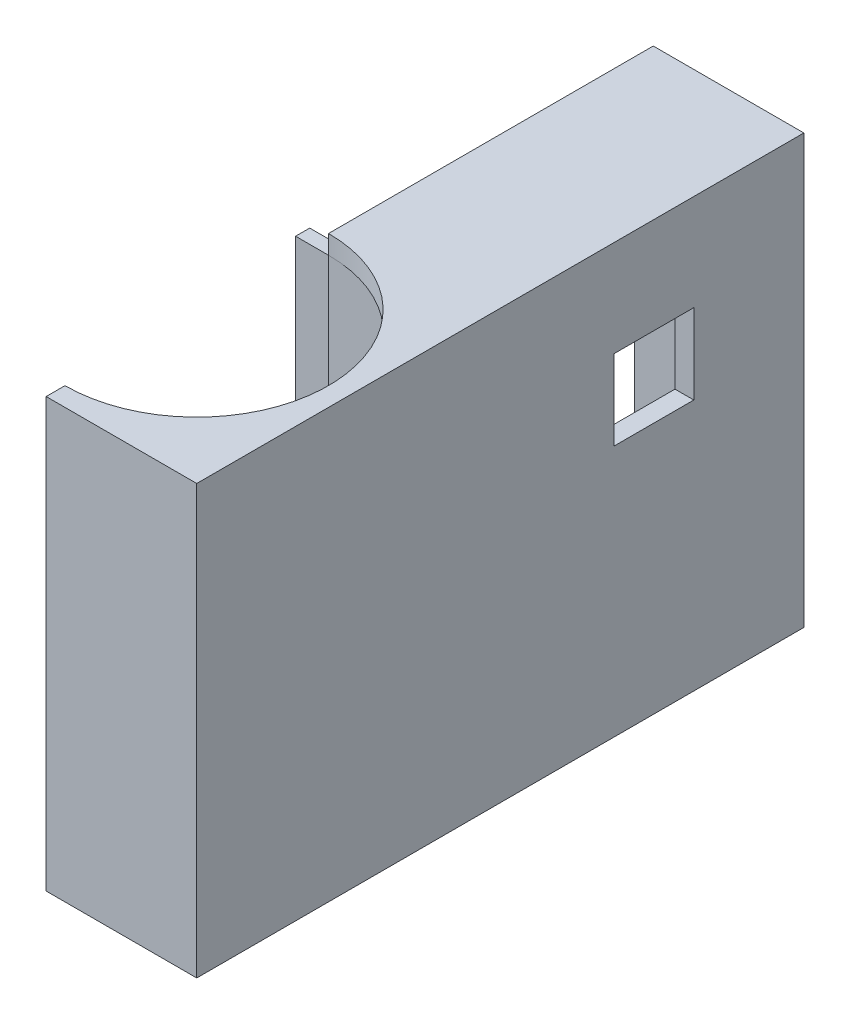
from build123d import *

# Parameters (mm, degrees)
SKETCH1_W           = 64.5
SKETCH1_H           = 45.5
SKETCH1_W_2         = 8.5
SKETCH1_H_2         = 8.5
BOSS_EXTRUDE1_DEPTH = 2
SKETCH2_W           = 64.5
SKETCH2_H           = 45.5
SKETCH2_W_2         = 28
SKETCH2_H_2         = 41.5
BOSS_EXTRUDE2_DEPTH = 14
CUT_EXTRUDE1_REACH  = 80.565
SKETCH3_R           = 14
SKETCH4_W           = 1.5
SKETCH4_H           = 38.5
BOSS_EXTRUDE3_DEPTH = 5
SKETCH5_W           = 15.24
SKETCH5_H           = 2
CUT_EXTRUDE2_DEPTH  = 7.62


with BuildPart() as part:
    # Sketch1 → Boss-Extrude1 (new body)
    with BuildSketch(Plane(origin=(0, 0, 0), x_dir=(0, 0, -1), z_dir=(1, 0, 0))):
        with Locations((30.25, 20.75)):
            Rectangle(SKETCH1_W, SKETCH1_H)
        with Locations((46.5590026, 29.024)):
            Rectangle(SKETCH1_W_2, SKETCH1_H_2, mode=Mode.SUBTRACT)
    extrude(amount=BOSS_EXTRUDE1_DEPTH)

    # Sketch2 → Boss-Extrude2 (add)
    with BuildSketch(Plane.ZY):
        with Locations((-30.25, 20.75)):
            Rectangle(SKETCH2_W, SKETCH2_H)
        with Locations((-46.5, 20.75)):
            Rectangle(SKETCH2_W_2, SKETCH2_H_2, mode=Mode.SUBTRACT)
        with Locations((-14, 20.75)):
            Rectangle(SKETCH2_W_2, SKETCH2_H_2, mode=Mode.SUBTRACT)
    extrude(amount=BOSS_EXTRUDE2_DEPTH)

    # Sketch3 → Cut-Extrude1 (cut, up to next)
    with BuildSketch(Plane(origin=(0, 43.5, 0), x_dir=(1, 0, 0), z_dir=(0, 1, 0)), mode=Mode.PRIVATE) as cut_extrude1_sk1:
        with Locations((-14, 14)):
            Circle(SKETCH3_R)
    cut_extrude1_tool1 = extrude(cut_extrude1_sk1.sketch, amount=-CUT_EXTRUDE1_REACH, mode=Mode.PRIVATE) & part.part
    add(cut_extrude1_tool1.solids().sort_by_distance((-14, 43.5, -14))[0], mode=Mode.SUBTRACT)

    # Sketch4 → Boss-Extrude3 (add)
    with BuildSketch(Plane.ZY.offset(14)):
        with Locations((-30.25, 20.75)):
            Rectangle(SKETCH4_W, SKETCH4_H)
    extrude(amount=BOSS_EXTRUDE3_DEPTH)

    # Sketch5 → Cut-Extrude2 (cut)
    with BuildSketch(Plane.ZY.offset(14)):
        with Locations((-47.26, -1)):
            Rectangle(SKETCH5_W, SKETCH5_H)
    extrude(amount=-CUT_EXTRUDE2_DEPTH, mode=Mode.SUBTRACT)


solid = part.part
